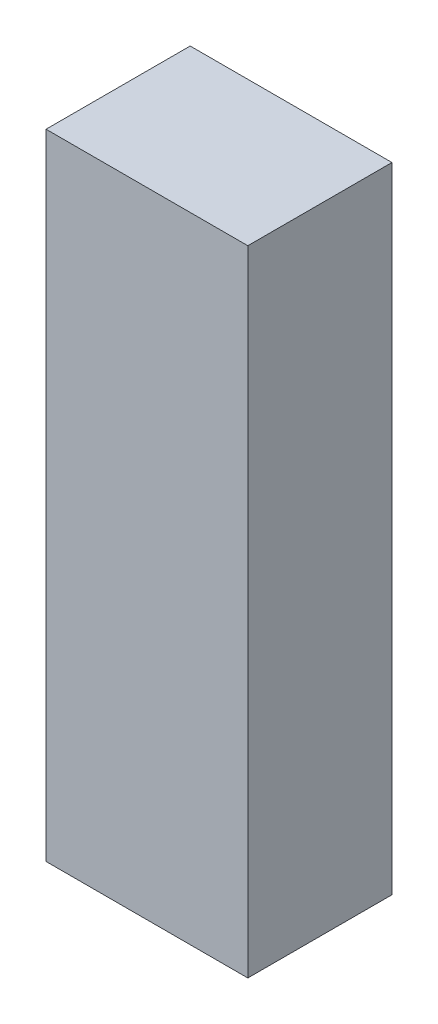
from build123d import *

# Parameters (mm, degrees)
SKETCH1_W           = 110
SKETCH1_H           = 35
BOSS_EXTRUDE1_DEPTH = 25


with BuildPart() as part:
    # Sketch1 → Boss-Extrude1 (new body)
    with BuildSketch(Plane(origin=(0, 0, 0), x_dir=(0, 1, 0), z_dir=(0, 0, 1))):
        with Locations((55, -17.5)):
            Rectangle(SKETCH1_W, SKETCH1_H)
    extrude(amount=BOSS_EXTRUDE1_DEPTH)


solid = part.part
